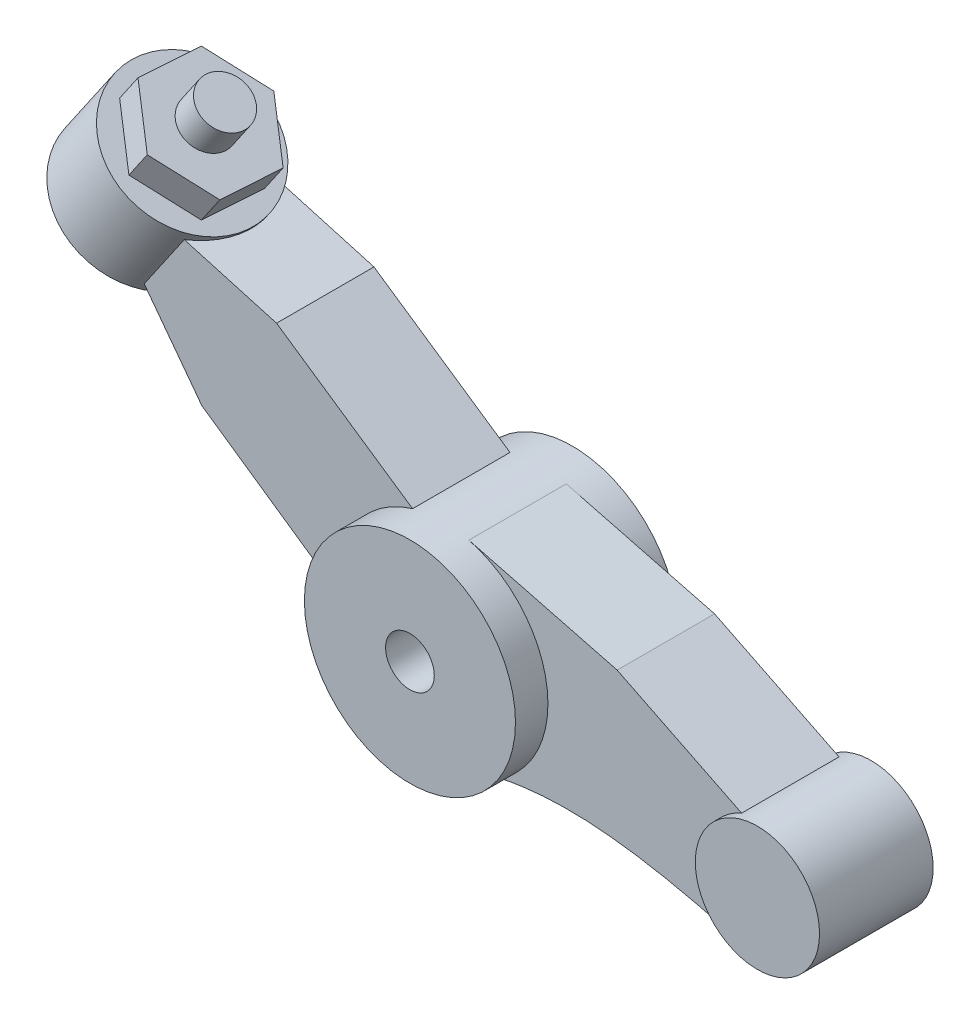
from build123d import *

# Parameters (mm, degrees)
SKETCH1_R           = 0.3
BOSS_EXTRUDE1_DEPTH = 1
BOSS_EXTRUDE2_DEPTH = 0.7
BOSS_EXTRUDE3_DEPTH = 0.6
BOSS_EXTRUDE4_DEPTH = 0.6
BOSS_EXTRUDE5_DEPTH = 0.4
SKETCH5_R           = 0.3
BOSS_EXTRUDE6_DEPTH = 0.4


with BuildPart() as part:
    # Sketch1 → Boss-Extrude1 (new, symmetric)
    with BuildSketch(Plane.XY):
        with BuildLine():
            ThreePointArc((1.3, 0), (1.02804324, 0.795692841), (0.325958313, 1.258471763))
            ThreePointArc((0.325958313, 1.258471763), (-0.021576108, 1.299820938), (-0.36754671, 1.24696007))
            ThreePointArc((-0.36754671, 1.24696007), (-1.071749439, 0.735767042), (-1.295745132, -0.105093068))
            ThreePointArc((-1.295745132, -0.105093068), (-0.573001329, -1.166905942), (0.709115587, -1.089566466))
            ThreePointArc((0.709115587, -1.089566466), (1.142770813, -0.619737742), (1.3, 0))
        make_face()
        Circle(SKETCH1_R, mode=Mode.SUBTRACT)
    extrude(amount=BOSS_EXTRUDE1_DEPTH, both=True)



with BuildPart() as body_2:
    # Sketch1<3> → Boss-Extrude2 (new, symmetric)
    with BuildSketch(Plane.XY):
        with BuildLine():
            ThreePointArc((4.745, -0.68), (4.404295551, -0.043448128), (3.685658077, 0.026107522))
            ThreePointArc((3.685658077, 0.026107522), (3.217306903, -0.620634696), (3.579943327, -1.332058018))
            ThreePointArc((3.579943327, -1.332058018), (4.353618552, -1.34755837), (4.745, -0.68))
        make_face()
    extrude(amount=BOSS_EXTRUDE2_DEPTH, both=True)


with BuildPart() as part_1:
    add(part.part)

    add(body_2.part)  # Boss-Extrude3 merges body 2
    # Sketch1<4> → Boss-Extrude3 (add, symmetric)
    with BuildSketch(Plane.XY):
        with BuildLine():
            Line((2.152301429, 0.785428395), (0.325958313, 1.258471763))
            ThreePointArc((0.325958313, 1.258471763), (1.02804324, 0.795692841), (1.3, 0))
            ThreePointArc((1.3, 0), (1.142770813, -0.619737742), (0.709115587, -1.089566466))
            add(Edge.make_bspline(
                [(3.579943327, -1.332058018), (2.651549226, -1.086241339), (1.670075627, -0.883873745), (0.709115587, -1.089566466)],
                knots=[0, 0, 0, 0, 1, 1, 1, 1], degree=3))
            ThreePointArc((3.579943327, -1.332058018), (3.217306903, -0.620634696), (3.685658077, 0.026107522))
            Line((3.685658077, 0.026107522), (2.152301429, 0.785428395))
        make_face()
    extrude(amount=BOSS_EXTRUDE3_DEPTH, both=True)

    # Sketch1<5> → Boss-Extrude4 (add, symmetric)
    with BuildSketch(Plane.XY):
        with BuildLine():
            ThreePointArc((-1.295745132, -0.105093068), (-1.071749439, 0.735767042), (-0.36754671, 1.24696007))
            Line((-0.36754671, 1.24696007), (-2.042763802, 2.388420801))
            Line((-2.042763802, 2.388420801), (-3.468005165, 2.793231136))
            Line((-3.468005165, 2.793231136), (-3.852867925, 2.232623737))
            Line((-3.852867925, 2.232623737), (-2.962943123, 1.048048625))
            Line((-2.962943123, 1.048048625), (-1.295745132, -0.105093068))
        make_face()
    extrude(amount=BOSS_EXTRUDE4_DEPTH, both=True)



with BuildPart() as body_2_2:
    # Sketch2 → Revolve1 (revolve)
    with BuildSketch(Plane.XY):
        with BuildLine():
            Line((-3.852867925, 2.232623737), (-3.445366179, 2.826208042))
            Line((-3.445366179, 2.826208042), (-3.775135237, 3.052597901))
            Line((-3.775135237, 3.052597901), (-4.837794635, 1.50468321))
            ThreePointArc((-4.837794635, 1.50468321), (-4.410872151, 1.528398717), (-4.325469227, 1.947363599))
            Line((-4.325469227, 1.947363599), (-3.852867925, 2.232623737))
        make_face()
    revolve(axis=Axis((-3.775135237, 3.052597901, 0), (-0.5659746478395021, -0.8244226452511791, 0)))


with BuildPart() as part_2:
    add(part_1.part)

    add(body_2_2.part)  # Revolve2 merges body 2 2
    # Sketch3 → Revolve2 (revolve)
    with BuildSketch(Plane.XY):
        Polygon((-3.681934751, 3.188357677), (-4.29318737, 2.29798122), (-5.043411978, 2.813018149), (-4.432159358, 3.703394606), align=None)
    revolve(axis=Axis((-3.681934751, 3.188357677, 0), (-0.5659746478395028, -0.8244226452511788, 0)))


with BuildPart() as body_2_3:
    # Sketch4 → Boss-Extrude5 (new body)
    with BuildSketch(Plane(origin=(0.308270852, 0.449040381, 0), x_dir=(0.8244226452511786, -0.5659746478395029, 0), z_dir=(0.5659746478395029, 0.8244226452511786, 0))):
        Polygon((-4.208750665, -0.406026614), (-4.172745971, 0.343664653), (-4.803995305, 0.749691267), (-5.471249335, 0.406026614), (-5.507254029, -0.343664653), (-4.876004695, -0.749691267), align=None)
    extrude(amount=BOSS_EXTRUDE5_DEPTH)


with BuildPart() as body_3:
    # Sketch5 → Boss-Extrude6 (new body)
    with BuildSketch(Plane(origin=(0.534660711, 0.778809439, 0), x_dir=(0.8244226452511789, -0.5659746478395026, 0), z_dir=(0.5659746478395025, 0.8244226452511788, 0))):
        with Locations((-4.860055954, -0.03118098)):
            Circle(SKETCH5_R)
    extrude(amount=BOSS_EXTRUDE6_DEPTH)


solid = Compound([part_2.part, body_2_3.part, body_3.part])
